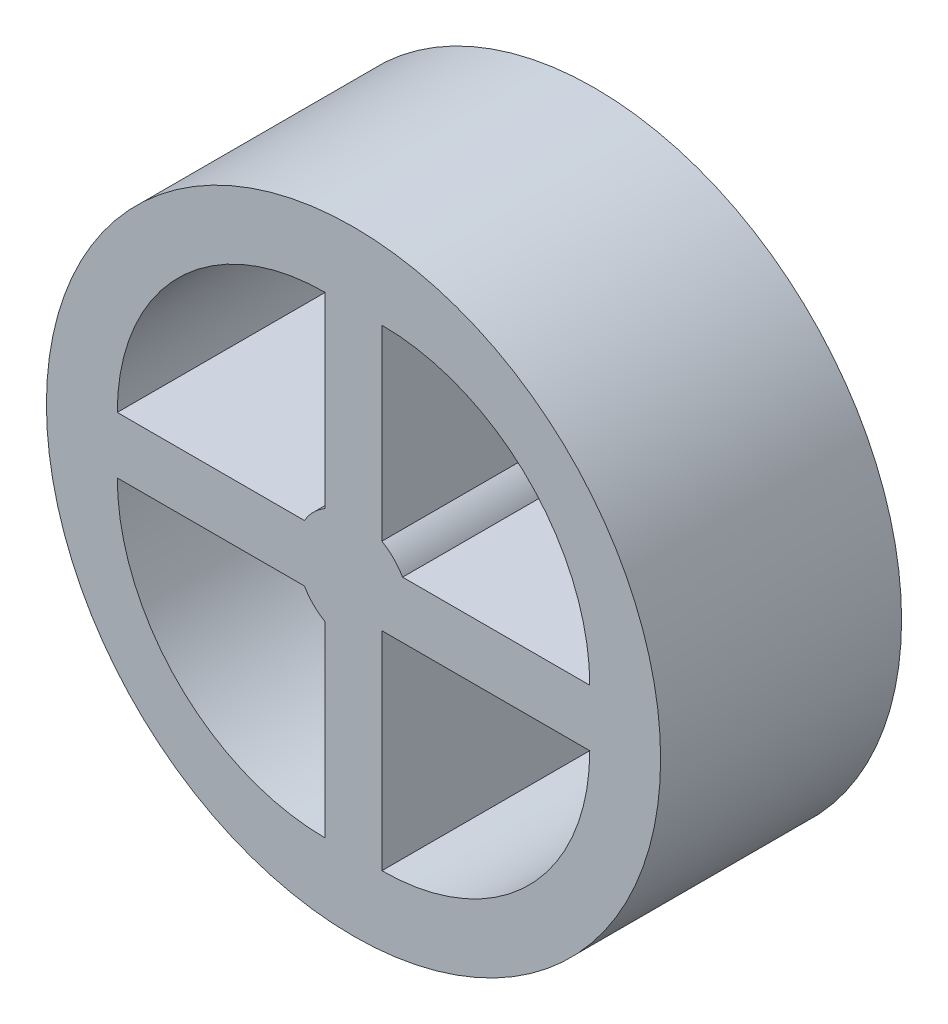
from build123d import *

# Parameters (mm, degrees)
SKETCH_1_R          = 325
EXTRUDE_1_DEPTH     = 255
CUT_EXTRUDE_2_DEPTH = 255
CUT_EXTRUDE_3_DEPTH = 255
CUT_EXTRUDE_5_DEPTH = 255
CUT_EXTRUDE_6_DEPTH = 255


with BuildPart() as part:
    # 草图1 → 凸台-拉伸1 (new body)
    with BuildSketch(Plane.XY):
        Circle(SKETCH_1_R)
    extrude(amount=EXTRUDE_1_DEPTH)

    # 草图2 → 切除-拉伸2 (cut)
    with BuildSketch(Plane.XY):
        with BuildLine():
            Line((51.961524227, 30), (250, 30))
            ThreePointArc((250, 30), (185.563491861, 185.563491861), (30, 250))
            Line((30, 250), (30, 51.961524227))
            ThreePointArc((30, 51.961524227), (42.426406871, 42.426406871), (51.961524227, 30))
        make_face()
    extrude(amount=CUT_EXTRUDE_2_DEPTH, mode=Mode.SUBTRACT)

    # 草图3 → 切除-拉伸3 (cut)
    with BuildSketch(Plane.XY):
        with BuildLine():
            Line((-30, 250), (-30, 51.961524227))
            ThreePointArc((-30, 51.961524227), (-42.426406871, 42.426406871), (-51.961524227, 30))
            Line((-51.961524227, 30), (-250, 30))
            ThreePointArc((-250, 30), (-185.563491861, 185.563491861), (-30, 250))
        make_face()
    extrude(amount=CUT_EXTRUDE_3_DEPTH, mode=Mode.SUBTRACT)

    # 草图7 → 切除-拉伸5 (cut)
    with BuildSketch(Plane.XY):
        with BuildLine():
            Line((-30, -51.961524227), (-30, -250))
            ThreePointArc((-30, -250), (-185.563491861, -185.563491861), (-250, -30))
            Line((-250, -30), (-51.961524227, -30))
            ThreePointArc((-51.961524227, -30), (-42.426406871, -42.426406871), (-30, -51.961524227))
        make_face()
    extrude(amount=CUT_EXTRUDE_5_DEPTH, mode=Mode.SUBTRACT)

    # 草图8 → 切除-拉伸6 (cut)
    with BuildSketch(Plane.XY):
        with BuildLine():
            Line((30, -30), (30, -250))
            ThreePointArc((30, -250), (185.563491861, -185.563491861), (250, -30))
            Line((250, -30), (30, -30))
        make_face()
    extrude(amount=CUT_EXTRUDE_6_DEPTH, mode=Mode.SUBTRACT)


solid = part.part
